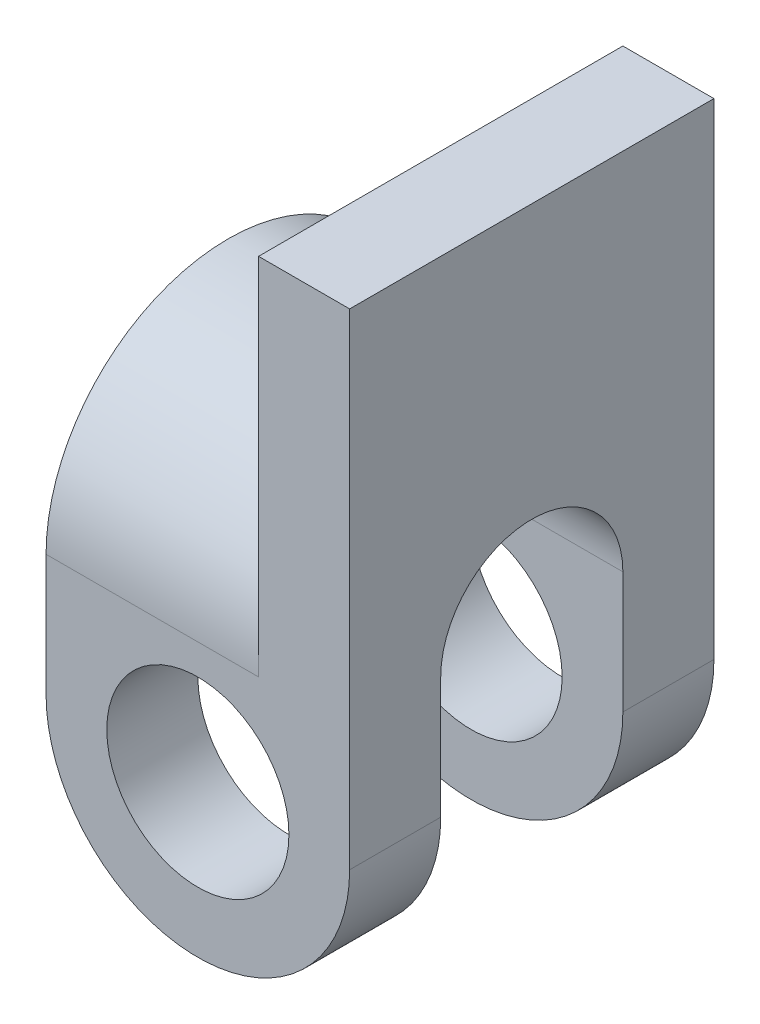
from build123d import *

# Parameters (mm, degrees)
SKETCH1_R           = 15
BOSS_EXTRUDE1_DEPTH = 60
BOSS_EXTRUDE2_DEPTH = 35
CUT_EXTRUDE9_DEPTH  = 68


with BuildPart() as part:
    # Sketch1 → Boss-Extrude1 (new body)
    with BuildSketch(Plane.XY):
        with BuildLine():
            Line((25, 0), (25, 80))
            Line((25, 80), (10, 80))
            Line((10, 80), (10, 20))
            Line((10, 20), (-25, 20))
            Line((-25, 20), (-25, 0))
            ThreePointArc((-25, 0), (0, -25), (25, 0))
        make_face()
        Circle(SKETCH1_R, mode=Mode.SUBTRACT)
    extrude(amount=BOSS_EXTRUDE1_DEPTH)

    # Sketch2 → Boss-Extrude2 (add)
    with BuildSketch(Plane.ZY.offset(25)):
        with BuildLine():
            Line((15, 20), (0, 20))
            ThreePointArc((0, 20), (30, 50), (60, 20))
            Line((60, 20), (45, 20))
            ThreePointArc((45, 20), (30, 35), (15, 20))
        make_face()
    extrude(amount=-BOSS_EXTRUDE2_DEPTH)

    # Sketch4 → Cut-Extrude9 (cut)
    with BuildSketch(Plane.ZY.offset(25)):
        with BuildLine():
            Line((15, 20), (15, -31.386315339))
            Line((15, -31.386315339), (45, -31.386315339))
            Line((45, -31.386315339), (45, 20))
            ThreePointArc((45, 20), (30, 35), (15, 20))
        make_face()
    extrude(amount=-CUT_EXTRUDE9_DEPTH, mode=Mode.SUBTRACT)


solid = part.part
